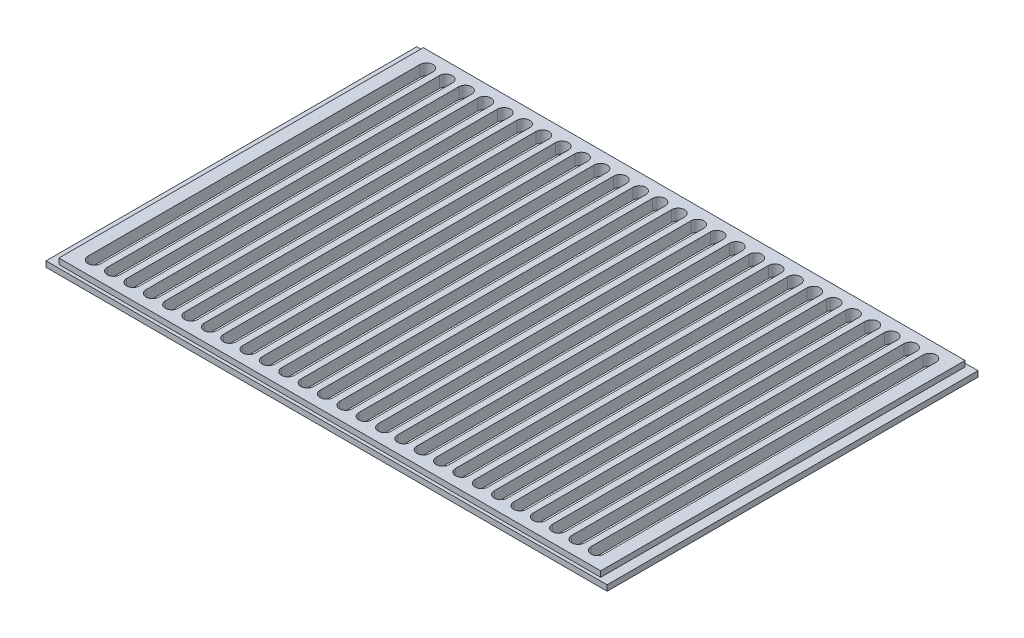
from build123d import *

# Parameters (mm, degrees)
SKETCH1_W               = 174
SKETCH1_H               = 115
BOSS_EXTRUDE1_DEPTH     = 1.75
SKETCH2_W               = 168
SKETCH2_H               = 113
SKETCH2_W_2             = 166
SKETCH2_H_2             = 111
BOSS_EXTRUDE2_DEPTH     = 1.75
CUT_EXTRUDE1_DEPTH      = 1.75
SKETCH4_W               = 166
SKETCH4_H               = 111
BOSS_EXTRUDE3_DEPTH     = 1.75
CUT_EXTRUDE2_DEPTH      = 209.576275017
CUT_EXTRUDE2_DEPTH_BACK = 209.576275017


with BuildPart() as part:
    # Sketch1 → Boss-Extrude1 (new body)
    with BuildSketch(Plane(origin=(0, 0, 0), x_dir=(1, 0, 0), z_dir=(0, 1, 0))):
        with Locations((87, 57.5)):
            Rectangle(SKETCH1_W, SKETCH1_H)
    extrude(amount=BOSS_EXTRUDE1_DEPTH)

    # Sketch2 → Boss-Extrude2 (add)
    with BuildSketch(Plane(origin=(0, 1.75, 0), x_dir=(1, 0, 0), z_dir=(0, 1, 0))):
        with Locations((87, 57.5)):
            Rectangle(SKETCH2_W, SKETCH2_H)
        with Locations((87, 57.5)):
            Rectangle(SKETCH2_W_2, SKETCH2_H_2, mode=Mode.SUBTRACT)
    extrude(amount=BOSS_EXTRUDE2_DEPTH)

    # Sketch3 → Cut-Extrude1 (cut)
    with BuildSketch(Plane(origin=(0, 1.75, 0), x_dir=(1, 0, 0), z_dir=(0, 1, 0))):
        with BuildLine():
            Line((11, 109), (11, 6))
            ThreePointArc((11, 6), (9, 4), (7, 6))
            Line((7, 6), (7, 109))
            ThreePointArc((7, 109), (9, 111), (11, 109))
        make_face()
        with BuildLine():
            Line((17, 109), (17, 6))
            ThreePointArc((17, 6), (15, 4), (13, 6))
            Line((13, 6), (13, 109))
            ThreePointArc((13, 109), (15, 111), (17, 109))
        make_face()
        with BuildLine():
            Line((23, 109), (23, 6))
            ThreePointArc((23, 6), (21, 4), (19, 6))
            Line((19, 6), (19, 109))
            ThreePointArc((19, 109), (21, 111), (23, 109))
        make_face()
        with BuildLine():
            Line((29, 109), (29, 6))
            ThreePointArc((29, 6), (27, 4), (25, 6))
            Line((25, 6), (25, 109))
            ThreePointArc((25, 109), (27, 111), (29, 109))
        make_face()
        with BuildLine():
            Line((35, 109), (35, 6))
            ThreePointArc((35, 6), (33, 4), (31, 6))
            Line((31, 6), (31, 109))
            ThreePointArc((31, 109), (33, 111), (35, 109))
        make_face()
        with BuildLine():
            Line((41, 109), (41, 6))
            ThreePointArc((41, 6), (39, 4), (37, 6))
            Line((37, 6), (37, 109))
            ThreePointArc((37, 109), (39, 111), (41, 109))
        make_face()
        with BuildLine():
            Line((47, 109), (47, 6))
            ThreePointArc((47, 6), (45, 4), (43, 6))
            Line((43, 6), (43, 109))
            ThreePointArc((43, 109), (45, 111), (47, 109))
        make_face()
        with BuildLine():
            Line((53, 109), (53, 6))
            ThreePointArc((53, 6), (51, 4), (49, 6))
            Line((49, 6), (49, 109))
            ThreePointArc((49, 109), (51, 111), (53, 109))
        make_face()
        with BuildLine():
            Line((59, 109), (59, 6))
            ThreePointArc((59, 6), (57, 4), (55, 6))
            Line((55, 6), (55, 109))
            ThreePointArc((55, 109), (57, 111), (59, 109))
        make_face()
        with BuildLine():
            Line((65, 109), (65, 6))
            ThreePointArc((65, 6), (63, 4), (61, 6))
            Line((61, 6), (61, 109))
            ThreePointArc((61, 109), (63, 111), (65, 109))
        make_face()
        with BuildLine():
            Line((71, 109), (71, 6))
            ThreePointArc((71, 6), (69, 4), (67, 6))
            Line((67, 6), (67, 109))
            ThreePointArc((67, 109), (69, 111), (71, 109))
        make_face()
        with BuildLine():
            Line((77, 109), (77, 6))
            ThreePointArc((77, 6), (75, 4), (73, 6))
            Line((73, 6), (73, 109))
            ThreePointArc((73, 109), (75, 111), (77, 109))
        make_face()
        with BuildLine():
            Line((83, 109), (83, 6))
            ThreePointArc((83, 6), (81, 4), (79, 6))
            Line((79, 6), (79, 109))
            ThreePointArc((79, 109), (81, 111), (83, 109))
        make_face()
        with BuildLine():
            Line((89, 109), (89, 6))
            ThreePointArc((89, 6), (87, 4), (85, 6))
            Line((85, 6), (85, 109))
            ThreePointArc((85, 109), (87, 111), (89, 109))
        make_face()
        with BuildLine():
            Line((95, 109), (95, 6))
            ThreePointArc((95, 6), (93, 4), (91, 6))
            Line((91, 6), (91, 109))
            ThreePointArc((91, 109), (93, 111), (95, 109))
        make_face()
        with BuildLine():
            Line((101, 109), (101, 6))
            ThreePointArc((101, 6), (99, 4), (97, 6))
            Line((97, 6), (97, 109))
            ThreePointArc((97, 109), (99, 111), (101, 109))
        make_face()
        with BuildLine():
            Line((107, 109), (107, 6))
            ThreePointArc((107, 6), (105, 4), (103, 6))
            Line((103, 6), (103, 109))
            ThreePointArc((103, 109), (105, 111), (107, 109))
        make_face()
        with BuildLine():
            Line((113, 109), (113, 6))
            ThreePointArc((113, 6), (111, 4), (109, 6))
            Line((109, 6), (109, 109))
            ThreePointArc((109, 109), (111, 111), (113, 109))
        make_face()
        with BuildLine():
            Line((119, 109), (119, 6))
            ThreePointArc((119, 6), (117, 4), (115, 6))
            Line((115, 6), (115, 109))
            ThreePointArc((115, 109), (117, 111), (119, 109))
        make_face()
        with BuildLine():
            Line((125, 109), (125, 6))
            ThreePointArc((125, 6), (123, 4), (121, 6))
            Line((121, 6), (121, 109))
            ThreePointArc((121, 109), (123, 111), (125, 109))
        make_face()
        with BuildLine():
            Line((131, 109), (131, 6))
            ThreePointArc((131, 6), (129, 4), (127, 6))
            Line((127, 6), (127, 109))
            ThreePointArc((127, 109), (129, 111), (131, 109))
        make_face()
        with BuildLine():
            Line((137, 109), (137, 6))
            ThreePointArc((137, 6), (135, 4), (133, 6))
            Line((133, 6), (133, 109))
            ThreePointArc((133, 109), (135, 111), (137, 109))
        make_face()
        with BuildLine():
            Line((143, 109), (143, 6))
            ThreePointArc((143, 6), (141, 4), (139, 6))
            Line((139, 6), (139, 109))
            ThreePointArc((139, 109), (141, 111), (143, 109))
        make_face()
        with BuildLine():
            Line((149, 109), (149, 6))
            ThreePointArc((149, 6), (147, 4), (145, 6))
            Line((145, 6), (145, 109))
            ThreePointArc((145, 109), (147, 111), (149, 109))
        make_face()
        with BuildLine():
            Line((155, 109), (155, 6))
            ThreePointArc((155, 6), (153, 4), (151, 6))
            Line((151, 6), (151, 109))
            ThreePointArc((151, 109), (153, 111), (155, 109))
        make_face()
        with BuildLine():
            Line((161, 109), (161, 6))
            ThreePointArc((161, 6), (159, 4), (157, 6))
            Line((157, 6), (157, 109))
            ThreePointArc((157, 109), (159, 111), (161, 109))
        make_face()
        with BuildLine():
            Line((167, 109), (167, 6))
            ThreePointArc((167, 6), (165, 4), (163, 6))
            Line((163, 6), (163, 109))
            ThreePointArc((163, 109), (165, 111), (167, 109))
        make_face()
    extrude(amount=-CUT_EXTRUDE1_DEPTH, mode=Mode.SUBTRACT)

    # Sketch4 → Boss-Extrude3 (add)
    with BuildSketch(Plane(origin=(0, 3.5, 0), x_dir=(1, 0, 0), z_dir=(0, 1, 0))):
        with Locations((87, 57.5)):
            Rectangle(SKETCH4_W, SKETCH4_H)
    extrude(amount=-BOSS_EXTRUDE3_DEPTH)

    # Sketch3<2> → Cut-Extrude2 (cut, two sides: drawn at the far end of the back side and taken through both)
    with BuildSketch(Plane(origin=(0, 1.75, 0), x_dir=(1, 0, 0), z_dir=(0, 1, 0)).offset(-CUT_EXTRUDE2_DEPTH_BACK)):
        with BuildLine():
            Line((11, 109), (11, 6))
            ThreePointArc((11, 6), (9, 4), (7, 6))
            Line((7, 6), (7, 109))
            ThreePointArc((7, 109), (9, 111), (11, 109))
        make_face()
        with BuildLine():
            Line((17, 109), (17, 6))
            ThreePointArc((17, 6), (15, 4), (13, 6))
            Line((13, 6), (13, 109))
            ThreePointArc((13, 109), (15, 111), (17, 109))
        make_face()
        with BuildLine():
            Line((23, 109), (23, 6))
            ThreePointArc((23, 6), (21, 4), (19, 6))
            Line((19, 6), (19, 109))
            ThreePointArc((19, 109), (21, 111), (23, 109))
        make_face()
        with BuildLine():
            Line((29, 109), (29, 6))
            ThreePointArc((29, 6), (27, 4), (25, 6))
            Line((25, 6), (25, 109))
            ThreePointArc((25, 109), (27, 111), (29, 109))
        make_face()
        with BuildLine():
            Line((35, 109), (35, 6))
            ThreePointArc((35, 6), (33, 4), (31, 6))
            Line((31, 6), (31, 109))
            ThreePointArc((31, 109), (33, 111), (35, 109))
        make_face()
        with BuildLine():
            Line((41, 109), (41, 6))
            ThreePointArc((41, 6), (39, 4), (37, 6))
            Line((37, 6), (37, 109))
            ThreePointArc((37, 109), (39, 111), (41, 109))
        make_face()
        with BuildLine():
            Line((47, 109), (47, 6))
            ThreePointArc((47, 6), (45, 4), (43, 6))
            Line((43, 6), (43, 109))
            ThreePointArc((43, 109), (45, 111), (47, 109))
        make_face()
        with BuildLine():
            Line((53, 109), (53, 6))
            ThreePointArc((53, 6), (51, 4), (49, 6))
            Line((49, 6), (49, 109))
            ThreePointArc((49, 109), (51, 111), (53, 109))
        make_face()
        with BuildLine():
            Line((59, 109), (59, 6))
            ThreePointArc((59, 6), (57, 4), (55, 6))
            Line((55, 6), (55, 109))
            ThreePointArc((55, 109), (57, 111), (59, 109))
        make_face()
        with BuildLine():
            Line((65, 109), (65, 6))
            ThreePointArc((65, 6), (63, 4), (61, 6))
            Line((61, 6), (61, 109))
            ThreePointArc((61, 109), (63, 111), (65, 109))
        make_face()
        with BuildLine():
            Line((71, 109), (71, 6))
            ThreePointArc((71, 6), (69, 4), (67, 6))
            Line((67, 6), (67, 109))
            ThreePointArc((67, 109), (69, 111), (71, 109))
        make_face()
        with BuildLine():
            Line((77, 109), (77, 6))
            ThreePointArc((77, 6), (75, 4), (73, 6))
            Line((73, 6), (73, 109))
            ThreePointArc((73, 109), (75, 111), (77, 109))
        make_face()
        with BuildLine():
            Line((83, 109), (83, 6))
            ThreePointArc((83, 6), (81, 4), (79, 6))
            Line((79, 6), (79, 109))
            ThreePointArc((79, 109), (81, 111), (83, 109))
        make_face()
        with BuildLine():
            Line((89, 109), (89, 6))
            ThreePointArc((89, 6), (87, 4), (85, 6))
            Line((85, 6), (85, 109))
            ThreePointArc((85, 109), (87, 111), (89, 109))
        make_face()
        with BuildLine():
            Line((95, 109), (95, 6))
            ThreePointArc((95, 6), (93, 4), (91, 6))
            Line((91, 6), (91, 109))
            ThreePointArc((91, 109), (93, 111), (95, 109))
        make_face()
        with BuildLine():
            Line((101, 109), (101, 6))
            ThreePointArc((101, 6), (99, 4), (97, 6))
            Line((97, 6), (97, 109))
            ThreePointArc((97, 109), (99, 111), (101, 109))
        make_face()
        with BuildLine():
            Line((107, 109), (107, 6))
            ThreePointArc((107, 6), (105, 4), (103, 6))
            Line((103, 6), (103, 109))
            ThreePointArc((103, 109), (105, 111), (107, 109))
        make_face()
        with BuildLine():
            Line((113, 109), (113, 6))
            ThreePointArc((113, 6), (111, 4), (109, 6))
            Line((109, 6), (109, 109))
            ThreePointArc((109, 109), (111, 111), (113, 109))
        make_face()
        with BuildLine():
            Line((119, 109), (119, 6))
            ThreePointArc((119, 6), (117, 4), (115, 6))
            Line((115, 6), (115, 109))
            ThreePointArc((115, 109), (117, 111), (119, 109))
        make_face()
        with BuildLine():
            Line((125, 109), (125, 6))
            ThreePointArc((125, 6), (123, 4), (121, 6))
            Line((121, 6), (121, 109))
            ThreePointArc((121, 109), (123, 111), (125, 109))
        make_face()
        with BuildLine():
            Line((131, 109), (131, 6))
            ThreePointArc((131, 6), (129, 4), (127, 6))
            Line((127, 6), (127, 109))
            ThreePointArc((127, 109), (129, 111), (131, 109))
        make_face()
        with BuildLine():
            Line((137, 109), (137, 6))
            ThreePointArc((137, 6), (135, 4), (133, 6))
            Line((133, 6), (133, 109))
            ThreePointArc((133, 109), (135, 111), (137, 109))
        make_face()
        with BuildLine():
            Line((143, 109), (143, 6))
            ThreePointArc((143, 6), (141, 4), (139, 6))
            Line((139, 6), (139, 109))
            ThreePointArc((139, 109), (141, 111), (143, 109))
        make_face()
        with BuildLine():
            Line((149, 109), (149, 6))
            ThreePointArc((149, 6), (147, 4), (145, 6))
            Line((145, 6), (145, 109))
            ThreePointArc((145, 109), (147, 111), (149, 109))
        make_face()
        with BuildLine():
            Line((155, 109), (155, 6))
            ThreePointArc((155, 6), (153, 4), (151, 6))
            Line((151, 6), (151, 109))
            ThreePointArc((151, 109), (153, 111), (155, 109))
        make_face()
        with BuildLine():
            Line((161, 109), (161, 6))
            ThreePointArc((161, 6), (159, 4), (157, 6))
            Line((157, 6), (157, 109))
            ThreePointArc((157, 109), (159, 111), (161, 109))
        make_face()
        with BuildLine():
            Line((167, 109), (167, 6))
            ThreePointArc((167, 6), (165, 4), (163, 6))
            Line((163, 6), (163, 109))
            ThreePointArc((163, 109), (165, 111), (167, 109))
        make_face()
    extrude(amount=CUT_EXTRUDE2_DEPTH + CUT_EXTRUDE2_DEPTH_BACK, mode=Mode.SUBTRACT)


solid = part.part
